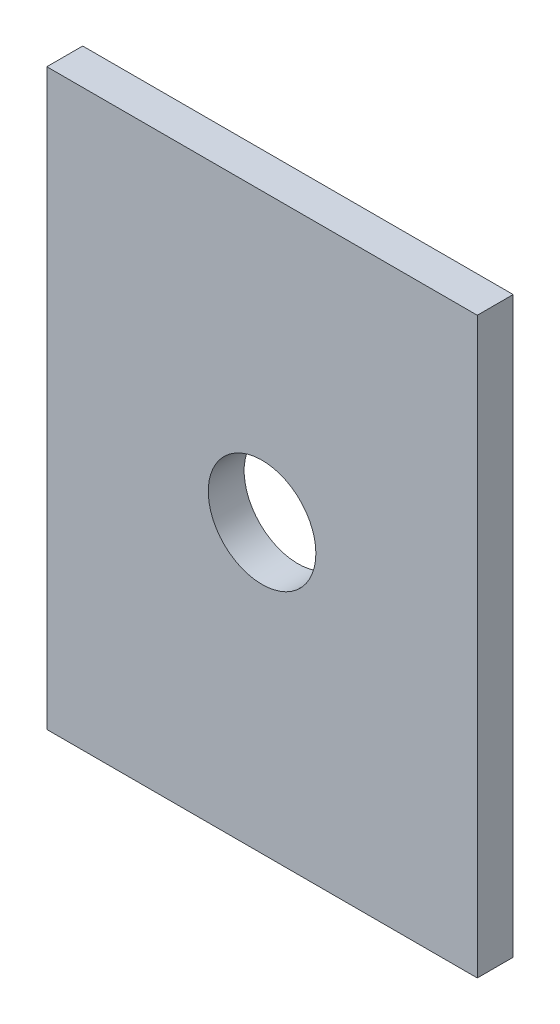
from build123d import *

# Parameters (mm, degrees)
SKETCH1_W           = 38.1
SKETCH1_H           = 50.8
SKETCH1_R           = 4.7625
BOSS_EXTRUDE1_DEPTH = 3.175


with BuildPart() as part:
    # Sketch1 → Boss-Extrude1 (new body)
    with BuildSketch(Plane.XY):
        Rectangle(SKETCH1_W, SKETCH1_H)
        Circle(SKETCH1_R, mode=Mode.SUBTRACT)
    extrude(amount=BOSS_EXTRUDE1_DEPTH)


solid = part.part
